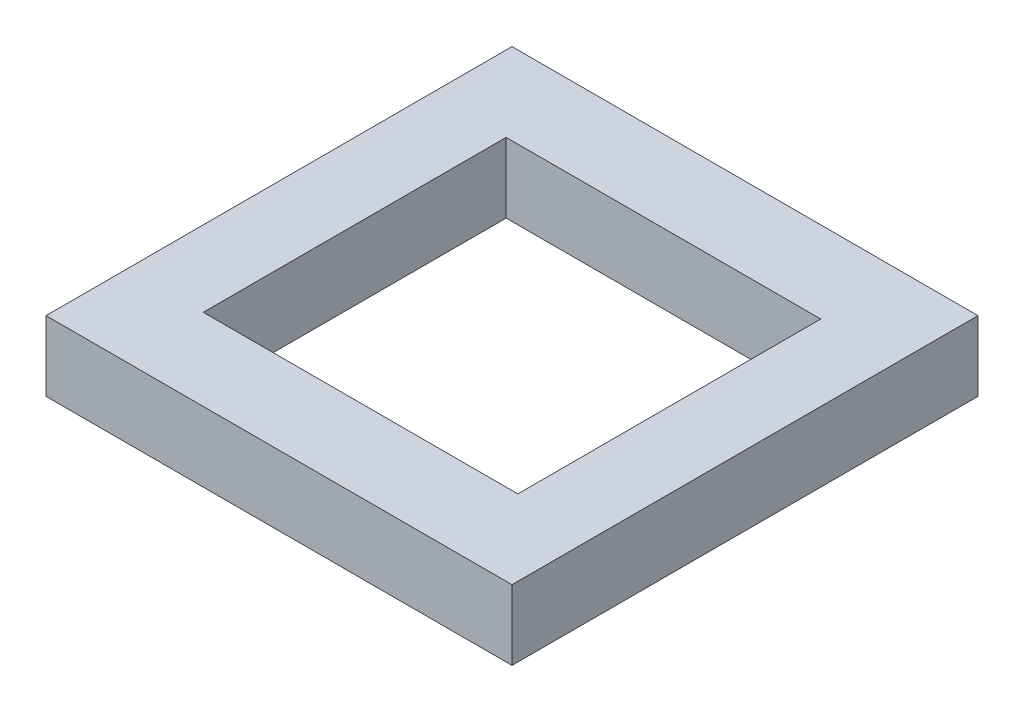
from build123d import *

# Parameters (mm, degrees)
SKETCH1_W           = 40
SKETCH1_H           = 40
SKETCH1_W_2         = 27
SKETCH1_H_2         = 26
BOSS_EXTRUDE1_DEPTH = 6


with BuildPart() as part:
    # Sketch1 → Boss-Extrude1 (new body)
    with BuildSketch(Plane(origin=(0, 0, 0), x_dir=(1, 0, 0), z_dir=(0, 1, 0))):
        Rectangle(SKETCH1_W, SKETCH1_H)
        Rectangle(SKETCH1_W_2, SKETCH1_H_2, mode=Mode.SUBTRACT)
    extrude(amount=BOSS_EXTRUDE1_DEPTH)


solid = part.part
